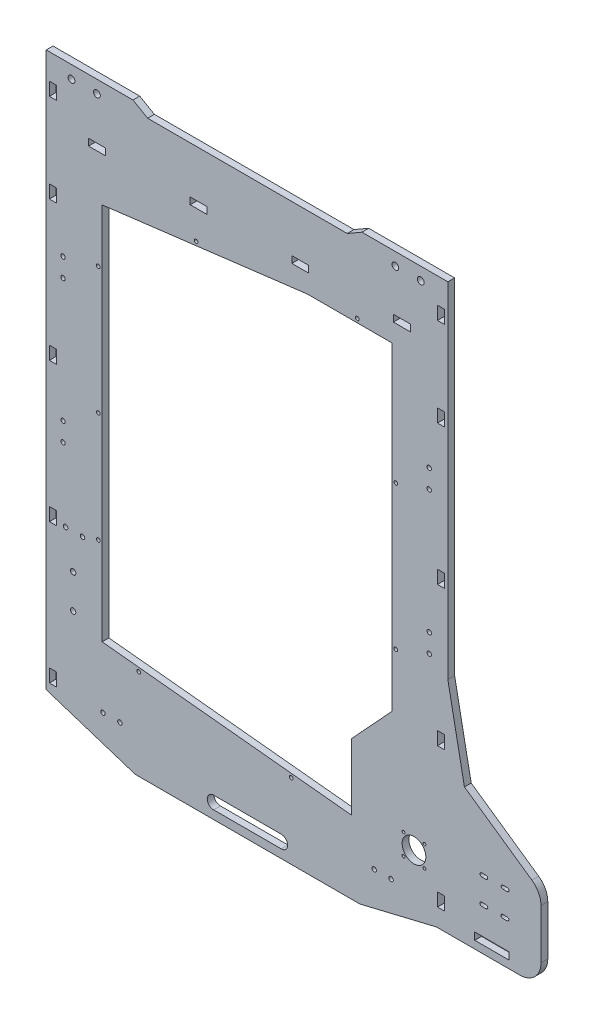
from build123d import *

# Parameters (mm, degrees)
ESQUISSE1_R              = 1.7
ESQUISSE1_R_2            = 14
ESQUISSE1_W              = 342.3
ESQUISSE1_H              = 506.843253
BOSS_EXTRU_1_DEPTH       = 8
ESQUISSE2_W              = 20
ESQUISSE2_H              = 8
ENL_V_MAT_EXTRU_1_DEPTH  = 10
ESQUISSE4_W              = 8.5
ESQUISSE4_H              = 15.5
ENL_V_MAT_EXTRU_2_DEPTH  = 10
ESQUISSE5_W              = 8.5
ESQUISSE5_H              = 15.5
ENL_V_MAT_EXTRU_3_DEPTH  = 10
ESQUISSE6_R              = 3.15
ESQUISSE6_R_2            = 2.65
ENL_V_MAT_EXTRU_4_DEPTH  = 10
BOSS_EXTRU_2_DEPTH       = 8
BOSS_EXTRU_3_DEPTH       = 8
BOSS_EXTRU_4_DEPTH       = 8
BOSS_EXTRU_5_DEPTH       = 8
ESQUISSE13_W             = 40.5
ESQUISSE13_H             = 8.5
ENL_V_MAT_EXTRU_6_DEPTH  = 10
ESQUISSE15_R             = 2.6
ENL_V_MAT_EXTRU_7_DEPTH  = 10
BOSS_EXTRU_6_DEPTH       = 8
CONG_1_R                 = 25
ESQUISSE17_R             = 4
ENL_V_MAT_EXTRU_8_DEPTH  = 10
ENL_V_MAT_EXTRU_9_DEPTH  = 10
ESQUISSE20_R             = 2.15
ENL_V_MAT_EXTRU_10_DEPTH = 30
ESQUISSE21_R             = 2.6
ENL_V_MAT_EXTRU_11_DEPTH = 11
ESQUISSE22_R             = 2.6
ENL_V_MAT_EXTRU_12_DEPTH = 10


with BuildPart() as part:
    # Esquisse1 → Boss.-Extru.1 (new body)
    with BuildSketch(Plane.XY):
        Polygon((40, -47), (-434.3, -47), (-434.3, 601.343253), (-331.846883663, 601.343253), (-314.526375587, 591.343253), (-78.820508076, 591.343253), (-61.5, 601.343253), (40, 601.343253), align=None)
        with Locations((-12.374368671, 12.374368671)):
            Circle(ESQUISSE1_R, mode=Mode.SUBTRACT)
        with Locations((12.374368671, 12.374368671)):
            Circle(ESQUISSE1_R, mode=Mode.SUBTRACT)
        with Locations((-12.374368671, -12.374368671)):
            Circle(ESQUISSE1_R, mode=Mode.SUBTRACT)
        with Locations((12.374368671, -12.374368671)):
            Circle(ESQUISSE1_R, mode=Mode.SUBTRACT)
        Circle(ESQUISSE1_R_2, mode=Mode.SUBTRACT)
        with Locations((-197.15, 252.4216265)):
            Rectangle(ESQUISSE1_W, ESQUISSE1_H, mode=Mode.SUBTRACT)
    extrude(amount=BOSS_EXTRU_1_DEPTH)

    # Esquisse2 → Enlèv. mat.-Extru.1 (cut)
    with BuildSketch(Plane.XY.offset(8)):
        with Locations((-254.3, 532)):
            Rectangle(ESQUISSE2_W, ESQUISSE2_H)
        with Locations((-374.3, 532)):
            Rectangle(ESQUISSE2_W, ESQUISSE2_H)
        with Locations((-134.3, 532)):
            Rectangle(ESQUISSE2_W, ESQUISSE2_H)
        with Locations((-14.3, 532)):
            Rectangle(ESQUISSE2_W, ESQUISSE2_H)
    extrude(amount=-ENL_V_MAT_EXTRU_1_DEPTH, mode=Mode.SUBTRACT)

    # Esquisse4 → Enlèv. mat.-Extru.2 (cut)
    with BuildSketch(Plane.XY.offset(8)):
        with Locations((32, -36.5)):
            Rectangle(ESQUISSE4_W, ESQUISSE4_H)
        with Locations((32, 128.5)):
            Rectangle(ESQUISSE4_W, ESQUISSE4_H)
        with Locations((32, 293.5)):
            Rectangle(ESQUISSE4_W, ESQUISSE4_H)
        with Locations((32, 458.5)):
            Rectangle(ESQUISSE4_W, ESQUISSE4_H)
        with Locations((32, 563.5)):
            Rectangle(ESQUISSE4_W, ESQUISSE4_H)
    extrude(amount=-ENL_V_MAT_EXTRU_2_DEPTH, mode=Mode.SUBTRACT)

    # Esquisse5 → Enlèv. mat.-Extru.3 (cut)
    with BuildSketch(Plane.XY.offset(8)):
        with Locations((-426.3, 458.5)):
            Rectangle(ESQUISSE5_W, ESQUISSE5_H)
        with Locations((-426.3, 293.5)):
            Rectangle(ESQUISSE5_W, ESQUISSE5_H)
        with Locations((-426.3, 128.5)):
            Rectangle(ESQUISSE5_W, ESQUISSE5_H)
        with Locations((-426.3, -36.5)):
            Rectangle(ESQUISSE5_W, ESQUISSE5_H)
        with Locations((-426.3, 563.5)):
            Rectangle(ESQUISSE5_W, ESQUISSE5_H)
    extrude(amount=-ENL_V_MAT_EXTRU_3_DEPTH, mode=Mode.SUBTRACT)

    # Esquisse6 → Enlèv. mat.-Extru.4 (cut)
    with BuildSketch(Plane.XY.offset(8)):
        with Locations((-402.5, 83.4)):
            Circle(ESQUISSE6_R)
        with Locations((-402.5, 43.4)):
            Circle(ESQUISSE6_R)
        with Locations((-391.438608853, 124.84)):
            Circle(ESQUISSE6_R_2)
        with Locations((-411.438608853, 124.84)):
            Circle(ESQUISSE6_R_2)
    extrude(amount=-ENL_V_MAT_EXTRU_4_DEPTH, mode=Mode.SUBTRACT)

    # Esquisse8 → Boss.-Extru.2 (add)
    with BuildSketch(Plane.XY.offset(8)):
        Polygon((-26, -1), (-74, -1), (-74, 77), (-26, 129), align=None)
        Polygon((-368.3, 29), (-368.3, -1), (-74, -1), align=None)
        Polygon((-368.3, 475.843253), (-126, 505.843253), (-368.3, 505.843253), align=None)
    extrude(amount=-BOSS_EXTRU_2_DEPTH)

    # Esquisse9 → Boss.-Extru.3 (add)
    with BuildSketch(Plane.XY.offset(8)):
        Polygon((-434.3, -47), (-434.3, -53), (-329.3, -87), (-64, -87), (40, -62), (40, -47), align=None)
        with BuildLine():
            Line((-236.65, -62), (-156.65, -62))
            ThreePointArc((-156.65, -62), (-149.15, -69.5), (-156.65, -77))
            Line((-156.65, -77), (-236.65, -77))
            ThreePointArc((-236.65, -77), (-244.15, -69.5), (-236.65, -62))
        make_face(mode=Mode.SUBTRACT)
    extrude(amount=-BOSS_EXTRU_3_DEPTH)

    # Esquisse11 → Boss.-Extru.4 (add)
    with BuildSketch(Plane(origin=(0, 0, 0), x_dir=(-1, 0, 0), z_dir=(0, 0, -1))):
        Polygon((-40, -62), (-117, -43.490384615), (-117, 54.509615385), (-59.554373535, 94.509615385), (-40, 194.509615385), align=None)
    extrude(amount=-BOSS_EXTRU_4_DEPTH)

    # Esquisse14 → Boss.-Extru.5 (add)
    with BuildSketch(Plane.XY.offset(8)):
        Polygon((26.5, -65.245192308), (117, -65.245192308), (117, -43.490384615), align=None)
    extrude(amount=-BOSS_EXTRU_5_DEPTH)

    # Esquisse13 → Enlèv. mat.-Extru.6 (cut)
    with BuildSketch(Plane.XY.offset(8)):
        with Locations((92, -52)):
            Rectangle(ESQUISSE13_W, ESQUISSE13_H)
    extrude(amount=-ENL_V_MAT_EXTRU_6_DEPTH, mode=Mode.SUBTRACT)

    # Esquisse15 → Enlèv. mat.-Extru.7 (cut)
    with BuildSketch(Plane.XY.offset(8)):
        with Locations((-414.438608853, 378)):
            Circle(ESQUISSE15_R)
        with Locations((-414.438608853, 400)):
            Circle(ESQUISSE15_R)
        with Locations((18, 400)):
            Circle(ESQUISSE15_R)
        with Locations((18, 378)):
            Circle(ESQUISSE15_R)
    extrude(amount=-ENL_V_MAT_EXTRU_7_DEPTH, mode=Mode.SUBTRACT)

    # Esquisse16 → Boss.-Extru.6 (add)
    with BuildSketch(Plane.XY.offset(8)):
        Polygon((117, 54.509615385), (150, 31.531364798), (150, -65.245192308), (117, -65.245192308), align=None)
    extrude(amount=-BOSS_EXTRU_6_DEPTH)

    # Congé1
    cong_1_edges = [part.edges().sort_by_distance(p)[0] for p in [
        (150, 31.531364798, 4),
        (150, -65.245192308, 4),
    ]]
    fillet(cong_1_edges, radius=CONG_1_R)

    # Esquisse17 → Enlèv. mat.-Extru.8 (cut)
    with BuildSketch(Plane.XY.offset(8)):
        with Locations((-404.438608853, 586.343252998)):
            Circle(ESQUISSE17_R)
        with Locations((-374.438608853, 586.343252998)):
            Circle(ESQUISSE17_R)
        with Locations((-22, 586.343253)):
            Circle(ESQUISSE17_R)
        with Locations((8, 586.343253)):
            Circle(ESQUISSE17_R)
    extrude(amount=-ENL_V_MAT_EXTRU_8_DEPTH, mode=Mode.SUBTRACT)

    # Esquisse19 → Enlèv. mat.-Extru.9 (cut)
    with BuildSketch(Plane.XY.offset(8)):
        with BuildLine():
            Line((110, -17.345192308), (105, -17.345192308))
            ThreePointArc((105, -17.345192308), (102.9, -15.245192308), (105, -13.145192308))
            Line((105, -13.145192308), (110, -13.145192308))
            ThreePointArc((110, -13.145192308), (112.1, -15.245192308), (110, -17.345192308))
        make_face()
        with BuildLine():
            Line((80, -13.115192308), (85, -13.115192308))
            ThreePointArc((85, -13.115192308), (87.13, -15.245192308), (85, -17.375192308))
            Line((85, -17.375192308), (80, -17.375192308))
            ThreePointArc((80, -17.375192308), (77.87, -15.245192308), (80, -13.115192308))
        make_face()
        with BuildLine():
            Line((110, 12.654807692), (105, 12.654807692))
            ThreePointArc((105, 12.654807692), (102.9, 14.754807692), (105, 16.854807692))
            Line((105, 16.854807692), (110, 16.854807692))
            ThreePointArc((110, 16.854807692), (112.1, 14.754807692), (110, 12.654807692))
        make_face()
        with BuildLine():
            Line((80, 16.854807692), (85, 16.854807692))
            ThreePointArc((85, 16.854807692), (87.1, 14.754807692), (85, 12.654807692))
            Line((85, 12.654807692), (80, 12.654807692))
            ThreePointArc((80, 12.654807692), (77.9, 14.754807692), (80, 16.854807692))
        make_face()
    extrude(amount=-ENL_V_MAT_EXTRU_9_DEPTH, mode=Mode.SUBTRACT)

    # Esquisse20 → Enlèv. mat.-Extru.10 (cut)
    with BuildSketch(Plane.XY.offset(8)):
        with Locations((-21.5, 194.843253)):
            Circle(ESQUISSE20_R)
        with Locations((-21.5, 364.843253)):
            Circle(ESQUISSE20_R)
        with Locations((-67, 510.343253)):
            Circle(ESQUISSE20_R)
        with Locations((-257.3, 494.120907239)):
            Circle(ESQUISSE20_R)
        with Locations((-372.8, 410.870792038)):
            Circle(ESQUISSE20_R)
        with Locations((-372.8, 260.870792038)):
            Circle(ESQUISSE20_R)
        with Locations((-372.8, 130.870792038)):
            Circle(ESQUISSE20_R)
        with Locations((-325, 20.062817018)):
            Circle(ESQUISSE20_R)
        with Locations((-145, 1.714193165)):
            Circle(ESQUISSE20_R)
    extrude(amount=-ENL_V_MAT_EXTRU_10_DEPTH, mode=Mode.SUBTRACT)

    # Esquisse21 → Enlèv. mat.-Extru.11 (cut)
    with BuildSketch(Plane(origin=(0, 0, 0), x_dir=(-1, 0, 0), z_dir=(0, 0, -1))):
        with Locations((47, -43)):
            Circle(ESQUISSE21_R)
        with Locations((27, -43)):
            Circle(ESQUISSE21_R)
        with Locations((367.3, -43)):
            Circle(ESQUISSE21_R)
        with Locations((347.3, -43)):
            Circle(ESQUISSE21_R)
    extrude(amount=-ENL_V_MAT_EXTRU_11_DEPTH, mode=Mode.SUBTRACT)

    # Esquisse22 → Enlèv. mat.-Extru.12 (cut)
    with BuildSketch(Plane(origin=(0, 0, 0), x_dir=(-1, 0, 0), z_dir=(0, 0, -1))):
        with Locations((-18, 232)):
            Circle(ESQUISSE22_R)
        with Locations((-18, 210)):
            Circle(ESQUISSE22_R)
        with Locations((414.438608853, 232)):
            Circle(ESQUISSE22_R)
        with Locations((414.438608853, 210)):
            Circle(ESQUISSE22_R)
    extrude(amount=-ENL_V_MAT_EXTRU_12_DEPTH, mode=Mode.SUBTRACT)


solid = part.part
